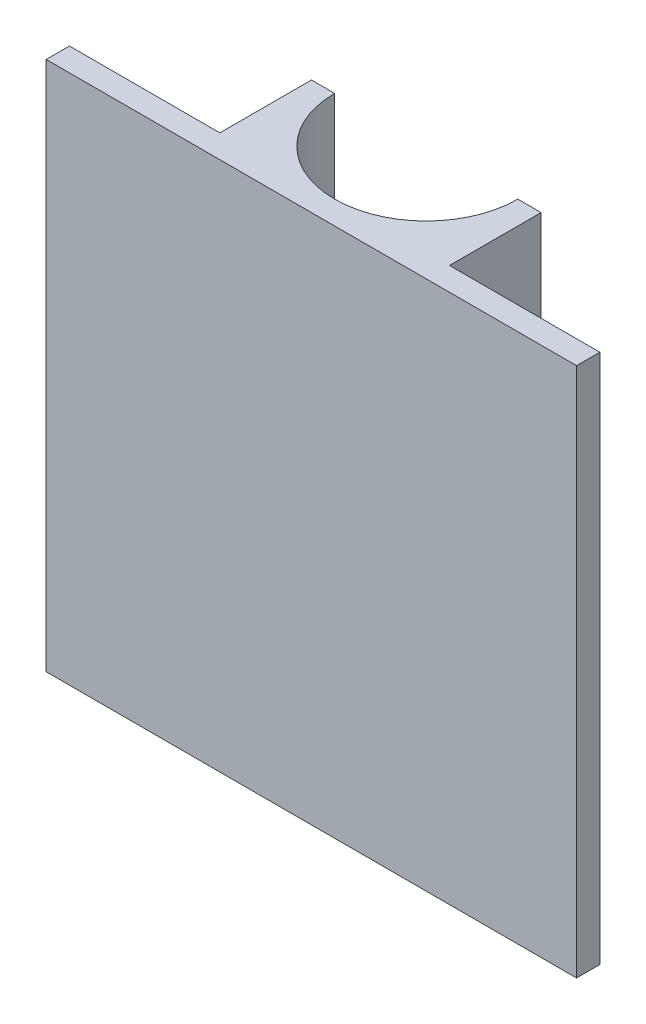
from build123d import *

# Parameters (mm, degrees)
BOSS_EXTRUDE4_DEPTH = 51.39
BOSS_EXTRUDE5_DEPTH = 72.39


with BuildPart() as part:
    # Sketch1 → Boss-Extrude4 (new body)
    with BuildSketch(Plane(origin=(0, 0, 0), x_dir=(1, 0, 0), z_dir=(0, 1, 0))):
        with BuildLine():
            ThreePointArc((18.7283116, 30.198170271), (6.5283116, 17.99817027), (-5.6716884, 30.198170271))
            Line((-5.6716884, 30.198170271), (-9.146688396, 30.198170271))
            Line((-9.146688396, 30.198170271), (-9.146688396, 17.698170271))
            Line((-9.146688396, 17.698170271), (-29.681604426, 17.698170271))
            Line((-29.681604426, 17.698170271), (-29.681604426, 14.523170271))
            Line((-29.681604426, 14.523170271), (42.719057074, 14.523170271))
            Line((42.719057074, 14.523170271), (42.719057074, 17.698170271))
            Line((42.719057074, 17.698170271), (22.203311604, 17.698170271))
            Line((22.203311604, 17.698170271), (22.203311604, 30.198170271))
            Line((22.203311604, 30.198170271), (18.7283116, 30.198170271))
        make_face()
    extrude(amount=BOSS_EXTRUDE4_DEPTH)

    # Sketch1<9> → Boss-Extrude5 (add)
    with BuildSketch(Plane(origin=(0, 0, 0), x_dir=(1, 0, 0), z_dir=(0, 1, 0))):
        with BuildLine():
            Line((-5.971688396, 30.198170271), (-9.146688396, 30.198170271))
            Line((-9.146688396, 30.198170271), (-9.146688396, 17.698170271))
            Line((-9.146688396, 17.698170271), (-29.681604426, 17.698170271))
            Line((-29.681604426, 17.698170271), (-29.681604426, 14.523170271))
            Line((-29.681604426, 14.523170271), (42.719057074, 14.523170271))
            Line((42.719057074, 14.523170271), (42.719057074, 17.698170271))
            Line((42.719057074, 17.698170271), (22.203311604, 17.698170271))
            Line((22.203311604, 17.698170271), (22.203311604, 30.198170271))
            Line((22.203311604, 30.198170271), (19.028311604, 30.198170271))
            ThreePointArc((19.028311604, 30.198170271), (6.528311604, 17.698170271), (-5.971688396, 30.198170271))
        make_face()
    extrude(amount=BOSS_EXTRUDE5_DEPTH)


solid = part.part
